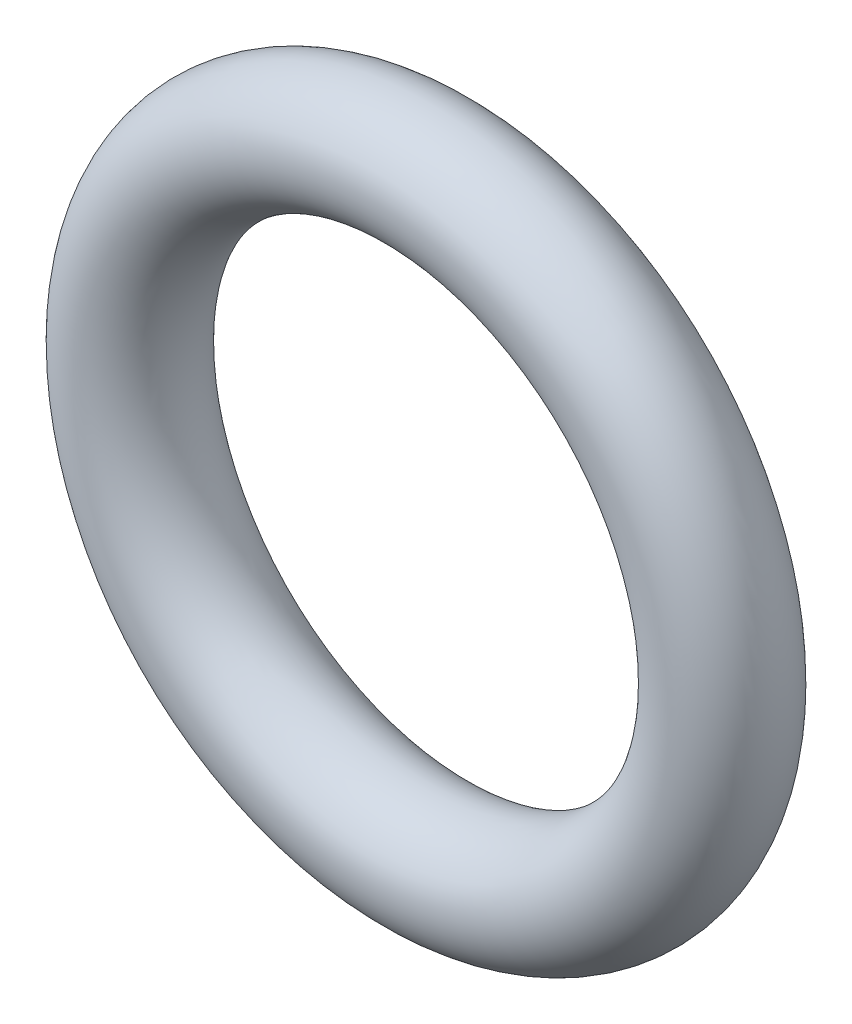
from build123d import *

# Parameters (mm, degrees)
SKETCH1_R = 1


with BuildPart() as part:
    # Sketch1 → Revolve1 (revolve)
    with BuildSketch(Plane(origin=(0, 0, 0), x_dir=(0, -1, 0), z_dir=(1, 0, 0)), mode=Mode.PRIVATE) as revolve1_sk:
        with Locations((5, 0)):
            Circle(SKETCH1_R)
    revolve(revolve1_sk.sketch.rotate(Axis((0, 0, 1), (0, 0, -1)), 270), axis=Axis((0, 0, 1), (0, 0, -1)))


solid = part.part
